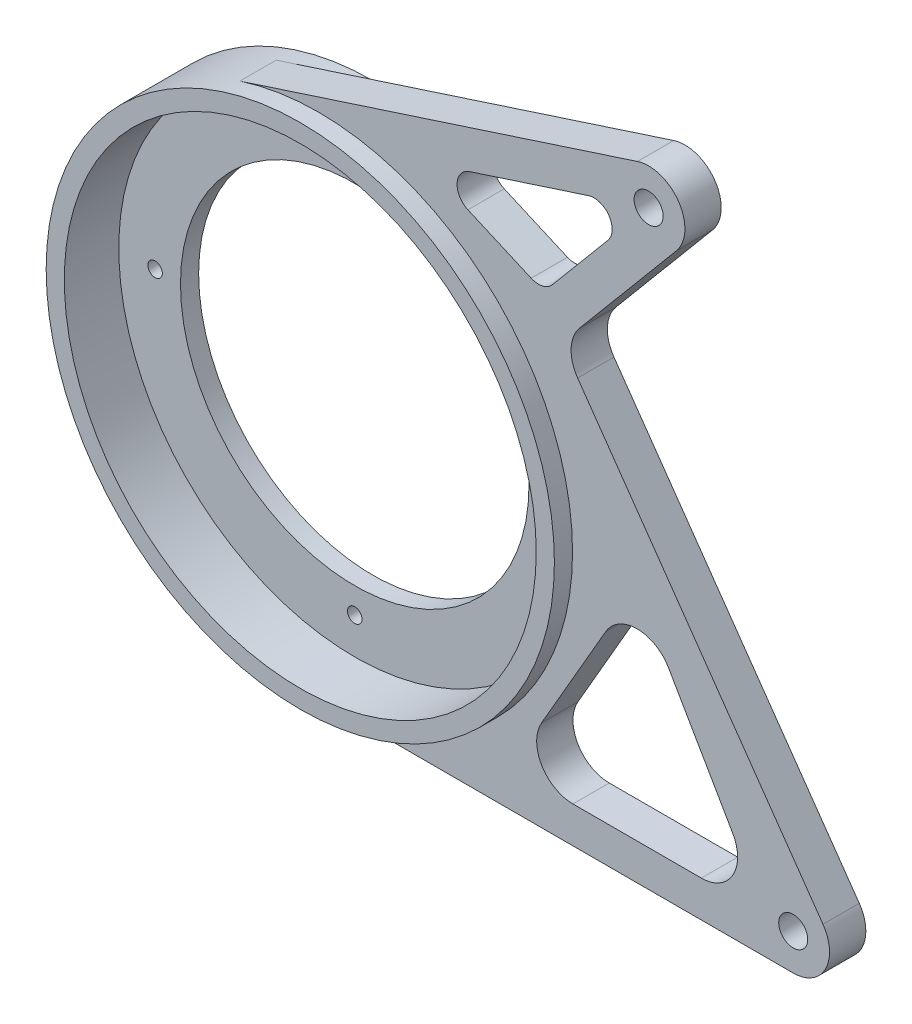
from build123d import *
from build123d.topology import SkipClean

# Parameters (mm, degrees)
SKETCH_1_R          = 70
SKETCH_1_R_2        = 48
SKETCH_1_R_3        = 2
EXTRUDE_3_DEPTH     = 5
SKETCH_2_R          = 70
SKETCH_2_R_2        = 65
EXTRUDE_4_DEPTH     = 15
SKETCH_4_R          = 4
EXTRUDE_5_DEPTH     = 20
CUT_EXTRUDE_START   = -5
CUT_EXTRUDE_1_DEPTH = 5
CUT_EXTRUDE_2_DEPTH = 5


with BuildPart() as part:
    # 草图1 → 凸台-拉伸3 (new body)
    with BuildSketch(Plane.XY):
        Circle(SKETCH_1_R)
        Circle(SKETCH_1_R_2, mode=Mode.SUBTRACT)
        with Locations((55, 0)):
            Circle(SKETCH_1_R_3, mode=Mode.SUBTRACT)
        with Locations((0, -55)):
            Circle(SKETCH_1_R_3, mode=Mode.SUBTRACT)
        with Locations((-55, 0)):
            Circle(SKETCH_1_R_3, mode=Mode.SUBTRACT)
        with Locations((0, 55)):
            Circle(SKETCH_1_R_3, mode=Mode.SUBTRACT)
    extrude(amount=EXTRUDE_3_DEPTH)

    # 草图2 → 凸台-拉伸4 (add)
    with BuildSketch(Plane.XY.offset(5)):
        Circle(SKETCH_2_R)
        Circle(SKETCH_2_R_2, mode=Mode.SUBTRACT)
    extrude(amount=EXTRUDE_4_DEPTH)

    # 草图4 → 凸台-拉伸5 (add)
    with BuildSketch(Plane.XY):
        with BuildLine():
            ThreePointArc((70, 0), (49.497474683, -49.497474683), (0, -70))
            Line((0, -70), (130.79017873, -70))
            ThreePointArc((130.79017873, -70), (139.660287062, -64.617486132), (138.981699173, -54.264235636))
            Line((138.981699173, -54.264235636), (71.400059285, 42.252348663))
            ThreePointArc((71.400059285, 42.252348663), (69.601097512, 48.4243069), (71.931135296, 54.415989123))
            Line((71.931135296, 54.415989123), (98.610619895, 86.211360741))
            ThreePointArc((98.610619895, 86.211360741), (99.240551189, 98.231165873), (87.86000552, 102.149802001))
            Line((87.86000552, 102.149802001), (-21.631189606, 66.573956141))
            ThreePointArc((-21.631189606, 66.573956141), (41.14496766, 56.631189606), (70, 0))
        make_face()
        with BuildLine():
            Line((105.469670655, -60), (70.110686806, -60))
            ThreePointArc((70.110686806, -60), (61.450432768, -55), (61.450432768, -45))
            Line((61.450432768, -45), (79.129924692, -14.378221735))
            ThreePointArc((79.129924692, -14.378221735), (87.79017873, -9.378221735), (96.450432768, -14.378221735))
            Line((96.450432768, -14.378221735), (114.129924692, -45))
            ThreePointArc((114.129924692, -45), (114.129924692, -55), (105.469670655, -60))
        make_face(mode=Mode.SUBTRACT)
        with Locations((130.79017873, -60)):
            Circle(SKETCH_4_R, mode=Mode.SUBTRACT)
        with BuildLine():
            Line((41.642562118, 76.618222088), (74.366534304, 87.25088519))
            ThreePointArc((74.366534304, 87.25088519), (80.056807139, 85.291567126), (79.741841492, 79.28166456))
            Line((79.741841492, 79.28166456), (64.430038128, 61.033767892))
            ThreePointArc((64.430038128, 61.033767892), (61.740626192, 59.379590093), (58.596293763, 59.66666905))
            Line((58.596293763, 59.66666905), (41.18412494, 67.281902615))
            ThreePointArc((41.18412494, 67.281902615), (38.193663865, 72.108156862), (41.642562118, 76.618222088))
        make_face(mode=Mode.SUBTRACT)
        with Locations((90.950175463, 92.639236838)):
            Circle(SKETCH_4_R, mode=Mode.SUBTRACT)
    extrude(amount=EXTRUDE_5_DEPTH)

    # 草图5 → 切除-拉伸1 (cut)
    with BuildSketch(Plane.XY.offset(20).offset(CUT_EXTRUDE_START)):
        with BuildLine():
            Line((-21.631189606, 66.573956141), (116.729087569, 111.529935371))
            Line((116.729087569, 111.529935371), (175.711739026, -70))
            Line((175.711739026, -70), (0, -70))
            ThreePointArc((0, -70), (69.138183842, 10.950412553), (-21.631189606, 66.573956141))
        make_face()
    extrude(amount=CUT_EXTRUDE_1_DEPTH, mode=Mode.SUBTRACT)

    # 草图6 → 切除-拉伸2 (cut)
    with SkipClean():  # the faces are left unmerged after this step: merging them gives an invalid solid
        with BuildSketch(Plane(origin=(0, 0, 0), x_dir=(-1, 0, 0), z_dir=(0, 0, -1))):
            with BuildLine():
                Line((0, -70), (-171.744818914, -70))
                Line((-171.744818914, -70), (-152.584469484, 114.8340827))
                Line((-152.584469484, 114.8340827), (-131.3396111, 125.799170899))
                Line((-131.3396111, 125.799170899), (25.232046012, 65.294286535))
                ThreePointArc((25.232046012, 65.294286535), (-68.813516323, 12.833548663), (0, -70))
            make_face()
        extrude(amount=-CUT_EXTRUDE_2_DEPTH, mode=Mode.SUBTRACT)


solid = part.part
